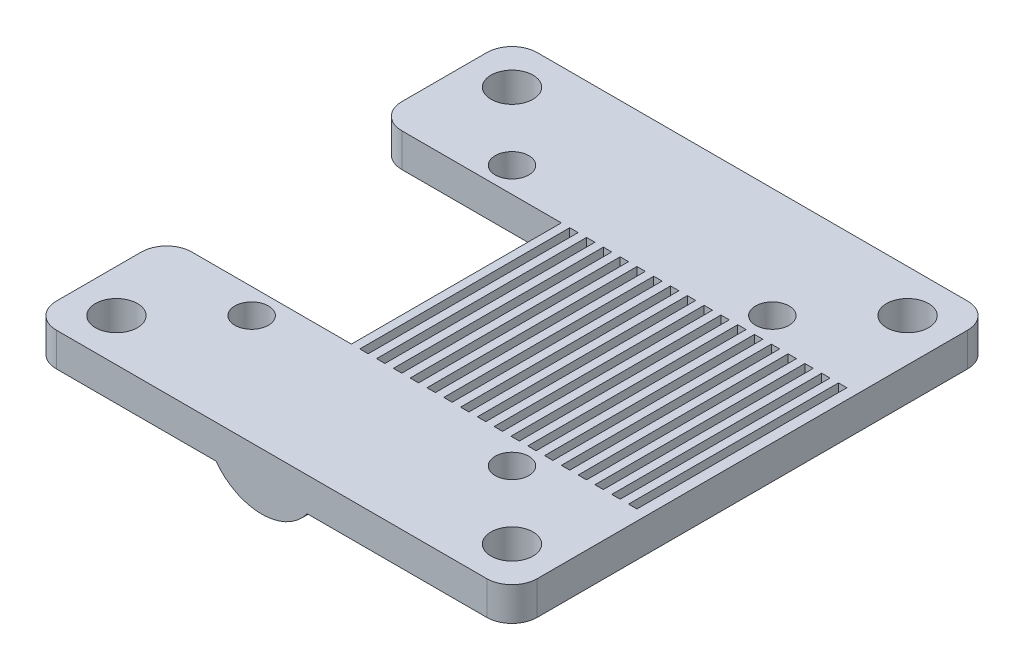
from build123d import *

# Parameters (mm, degrees)
SKETCH1_R           = 2
SKETCH1_R_2         = 2.5
BOSS_EXTRUDE1_DEPTH = 4
SKETCH2_W           = 1
SKETCH2_H           = 25
CUT_EXTRUDE1_DEPTH  = 1
SKETCH3_W           = 22
SKETCH3_H           = 25
CUT_EXTRUDE2_DEPTH  = 41.679002569
BOSS_EXTRUDE2_REACH = 66.132
FILLET1_R           = 3


with BuildPart() as part:
    # Sketch1 → Boss-Extrude1 (new body)
    with BuildSketch(Plane(origin=(0, 0, 0), x_dir=(1, 0, 0), z_dir=(0, 1, 0))):
        with BuildLine():
            Line((25.625, 28.625), (-25.625, 28.625))
            ThreePointArc((-25.625, 28.625), (-27.746320344, 27.746320344), (-28.625, 25.625))
            Line((-28.625, 25.625), (-28.625, -25.625))
            ThreePointArc((-28.625, -25.625), (-27.746320344, -27.746320344), (-25.625, -28.625))
            Line((-25.625, -28.625), (25.625, -28.625))
            ThreePointArc((25.625, -28.625), (27.746320344, -27.746320344), (28.625, -25.625))
            Line((28.625, -25.625), (28.625, 25.625))
            ThreePointArc((28.625, 25.625), (27.746320344, 27.746320344), (25.625, 28.625))
        make_face()
        with Locations(Location((-15.5, 15.5, 0), (0, 0, 270))):
            Circle(SKETCH1_R, mode=Mode.SUBTRACT)
        with Locations(Location((-23.55, 23.55, 0), (0, 0, 270))):
            Circle(SKETCH1_R_2, mode=Mode.SUBTRACT)
        with Locations(Location((23.55, 23.55, 0), (0, 0, 270))):
            Circle(SKETCH1_R_2, mode=Mode.SUBTRACT)
        with Locations(Location((15.5, 15.5, 0), (0, 0, 270))):
            Circle(SKETCH1_R, mode=Mode.SUBTRACT)
        with Locations(Location((15.5, -15.5, 0), (0, 0, 270))):
            Circle(SKETCH1_R, mode=Mode.SUBTRACT)
        with Locations(Location((-15.5, -15.5, 0), (0, 0, 270))):
            Circle(SKETCH1_R, mode=Mode.SUBTRACT)
        with Locations(Location((-23.55, -23.55, 0), (0, 0, 270))):
            Circle(SKETCH1_R_2, mode=Mode.SUBTRACT)
        with Locations(Location((23.55, -23.55, 0), (0, 0, 270))):
            Circle(SKETCH1_R_2, mode=Mode.SUBTRACT)
    extrude(amount=BOSS_EXTRUDE1_DEPTH)

    # Sketch2 → Cut-Extrude1 (cut)
    with BuildSketch(Plane(origin=(0, 4, 0), x_dir=(1, 0, 0), z_dir=(0, 1, 0))):
        with Locations((-27.125, 0)):
            Rectangle(SKETCH2_W, SKETCH2_H)
        with Locations((-25.125, 0)):
            Rectangle(SKETCH2_W, SKETCH2_H)
        with Locations((-23.125, 0)):
            Rectangle(SKETCH2_W, SKETCH2_H)
        with Locations((-21.125, 0)):
            Rectangle(SKETCH2_W, SKETCH2_H)
        with Locations((-19.125, 0)):
            Rectangle(SKETCH2_W, SKETCH2_H)
        with Locations((-17.125, 0)):
            Rectangle(SKETCH2_W, SKETCH2_H)
        with Locations((-15.125, 0)):
            Rectangle(SKETCH2_W, SKETCH2_H)
        with Locations((-13.125, 0)):
            Rectangle(SKETCH2_W, SKETCH2_H)
        with Locations((-11.125, 0)):
            Rectangle(SKETCH2_W, SKETCH2_H)
        with Locations((-9.125, 0)):
            Rectangle(SKETCH2_W, SKETCH2_H)
        with Locations((-7.125, 0)):
            Rectangle(SKETCH2_W, SKETCH2_H)
        with Locations((-5.125, 0)):
            Rectangle(SKETCH2_W, SKETCH2_H)
        with Locations((-3.125, 0)):
            Rectangle(SKETCH2_W, SKETCH2_H)
        with Locations((-1.125, 0)):
            Rectangle(SKETCH2_W, SKETCH2_H)
        with Locations((0.875, 0)):
            Rectangle(SKETCH2_W, SKETCH2_H)
        with Locations((2.875, 0)):
            Rectangle(SKETCH2_W, SKETCH2_H)
        with Locations((4.875, 0)):
            Rectangle(SKETCH2_W, SKETCH2_H)
        with Locations((6.875, 0)):
            Rectangle(SKETCH2_W, SKETCH2_H)
        with Locations((8.875, 0)):
            Rectangle(SKETCH2_W, SKETCH2_H)
        with Locations((10.875, 0)):
            Rectangle(SKETCH2_W, SKETCH2_H)
        with Locations((12.875, 0)):
            Rectangle(SKETCH2_W, SKETCH2_H)
        with Locations((14.875, 0)):
            Rectangle(SKETCH2_W, SKETCH2_H)
        with Locations((16.875, 0)):
            Rectangle(SKETCH2_W, SKETCH2_H)
        with Locations((18.875, 0)):
            Rectangle(SKETCH2_W, SKETCH2_H)
        with Locations((20.875, 0)):
            Rectangle(SKETCH2_W, SKETCH2_H)
        with Locations((22.875, 0)):
            Rectangle(SKETCH2_W, SKETCH2_H)
        with Locations((24.875, 0)):
            Rectangle(SKETCH2_W, SKETCH2_H)
        with Locations((26.875, 0)):
            Rectangle(SKETCH2_W, SKETCH2_H)
    extrude(amount=-CUT_EXTRUDE1_DEPTH, mode=Mode.SUBTRACT)

    # Sketch3 → Cut-Extrude2 (cut, through all)
    with BuildSketch(Plane.XZ):
        with Locations((-17.625, 0)):
            Rectangle(SKETCH3_W, SKETCH3_H)
    extrude(amount=-CUT_EXTRUDE2_DEPTH, mode=Mode.SUBTRACT)

    # Boss-Extrude2: up to this face of the body (flat: up to its plane)
    boss_extrude2_end = Plane(part.part.faces().sort_by_distance((0, 2, 28.625))[0])
    # Sketch4 → Boss-Extrude2 (add, up to the picked face)
    with BuildSketch(Plane(origin=(0, 0, -28.625), x_dir=(-1, 0, 0), z_dir=(0, 0, -1)), mode=Mode.PRIVATE) as boss_extrude2_sk1:
        with BuildLine():
            Line((-4.249281585, 0), (6.625, 0))
            ThreePointArc((6.625, 0), (1.187859207, -2.75), (-4.249281585, 0))
        make_face()
    boss_extrude2_tool1 = split(extrude(boss_extrude2_sk1.sketch, amount=-BOSS_EXTRUDE2_REACH, mode=Mode.PRIVATE), bisect_by=boss_extrude2_end, keep=Keep.BOTH, mode=Mode.PRIVATE)
    add(boss_extrude2_tool1.solids().sort_by(Axis((-1.187859, -1.121798, -28.625), (0, 0, 1)))[0])

    # Fillet1
    fillet1_edges = [part.edges().sort_by_distance(p)[0] for p in [
        (-28.625, 2, 12.5),
        (-28.625, 2, -12.5),
    ]]
    fillet(fillet1_edges, radius=FILLET1_R)


solid = part.part
